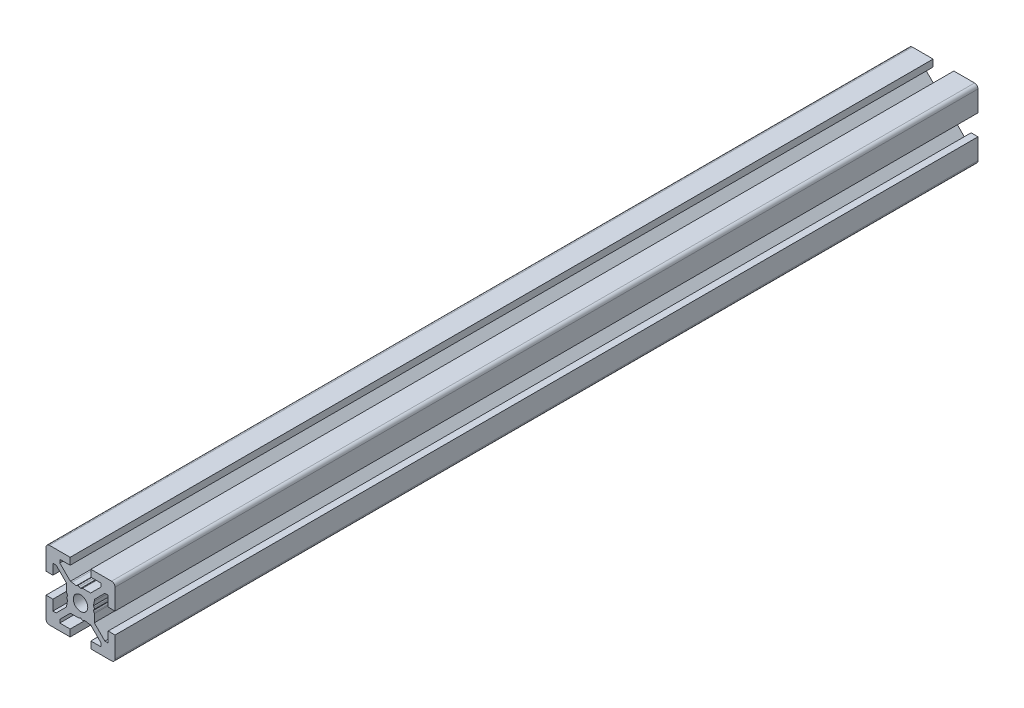
from build123d import *

# Parameters (mm, degrees)
SKETCH1_R           = 2.1
BOSS_EXTRUDE1_DEPTH = 250


with BuildPart() as part:
    # Sketch1 → Boss-Extrude1 (new body)
    with BuildSketch(Plane(origin=(0, 0, -2000), x_dir=(-1, 0, 0), z_dir=(0, 0, -1))):
        with BuildLine():
            Line((10, -3), (8, -3))
            Line((8, -3), (8, -6))
            Line((8, -6), (7.060660172, -6))
            Line((7.060660172, -6), (4, -2.939339828))
            Line((4, -2.939339828), (4, -2.5))
            Line((4, -2.5), (3.750976592, -1.218885629))
            Line((3.750976592, -1.218885629), (3.933012702, -0.903589838))
            ThreePointArc((3.933012702, -0.903589838), (4, -0.653589838), (3.933012702, -0.403589838))
            Line((3.933012702, -0.403589838), (3.7, 0))
            Line((3.7, 0), (3.933012702, 0.403589838))
            ThreePointArc((3.933012702, 0.403589838), (3.982962913, 0.524180316), (4, 0.653589838))
            Line((4, 0.653589838), (4, 2.939339828))
            Line((4, 2.939339828), (7.060660172, 6))
            Line((7.060660172, 6), (8, 6))
            Line((8, 6), (8, 3))
            Line((8, 3), (10, 3))
            Line((10, 3), (10, 9))
            ThreePointArc((10, 9), (9.707106781, 9.707106781), (9, 10))
            Line((9, 10), (3, 10))
            Line((3, 10), (3, 8))
            Line((3, 8), (6, 8))
            Line((6, 8), (6, 7.060660172))
            Line((6, 7.060660172), (2.939339828, 4))
            Line((2.939339828, 4), (2.5, 4))
            Line((2.5, 4), (1.218885629, 3.750976592))
            Line((1.218885629, 3.750976592), (0.903589838, 3.933012702))
            ThreePointArc((0.903589838, 3.933012702), (0.653589838, 4), (0.403589838, 3.933012702))
            Line((0.403589838, 3.933012702), (0, 3.7))
            Line((0, 3.7), (-0.403589838, 3.933012702))
            ThreePointArc((-0.403589838, 3.933012702), (-0.524180316, 3.982962913), (-0.653589838, 4))
            Line((-0.653589838, 4), (-2.939339828, 4))
            Line((-2.939339828, 4), (-6, 7.060660172))
            Line((-6, 7.060660172), (-6, 8))
            Line((-6, 8), (-3, 8))
            Line((-3, 8), (-3, 10))
            Line((-3, 10), (-9, 10))
            ThreePointArc((-9, 10), (-9.707106781, 9.707106781), (-10, 9))
            Line((-10, 9), (-10, 3))
            Line((-10, 3), (-8, 3))
            Line((-8, 3), (-8, 6))
            Line((-8, 6), (-7.060660172, 6))
            Line((-7.060660172, 6), (-4, 2.939339828))
            Line((-4, 2.939339828), (-4, 2.5))
            Line((-4, 2.5), (-3.750976592, 1.218885629))
            Line((-3.750976592, 1.218885629), (-3.933012702, 0.903589838))
            ThreePointArc((-3.933012702, 0.903589838), (-4, 0.653589838), (-3.933012702, 0.403589838))
            Line((-3.933012702, 0.403589838), (-3.7, 0))
            Line((-3.7, 0), (-3.933012702, -0.403589838))
            ThreePointArc((-3.933012702, -0.403589838), (-3.982962913, -0.524180316), (-4, -0.653589838))
            Line((-4, -0.653589838), (-4, -2.939339828))
            Line((-4, -2.939339828), (-7.060660172, -6))
            Line((-7.060660172, -6), (-8, -6))
            Line((-8, -6), (-8, -3))
            Line((-8, -3), (-10, -3))
            Line((-10, -3), (-10, -9))
            ThreePointArc((-10, -9), (-9.707106781, -9.707106781), (-9, -10))
            Line((-9, -10), (-3, -10))
            Line((-3, -10), (-3, -8))
            Line((-3, -8), (-6, -8))
            Line((-6, -8), (-6, -7.060660172))
            Line((-6, -7.060660172), (-2.939339828, -4))
            Line((-2.939339828, -4), (-2.5, -4))
            Line((-2.5, -4), (-1.218885629, -3.750976592))
            Line((-1.218885629, -3.750976592), (-0.903589838, -3.933012702))
            ThreePointArc((-0.903589838, -3.933012702), (-0.653589838, -4), (-0.403589838, -3.933012702))
            Line((-0.403589838, -3.933012702), (0, -3.7))
            Line((0, -3.7), (0.403589838, -3.933012702))
            ThreePointArc((0.403589838, -3.933012702), (0.524180316, -3.982962913), (0.653589838, -4))
            Line((0.653589838, -4), (2.939339828, -4))
            Line((2.939339828, -4), (6, -7.060660172))
            Line((6, -7.060660172), (6, -8))
            Line((6, -8), (3, -8))
            Line((3, -8), (3, -10))
            Line((3, -10), (9, -10))
            ThreePointArc((9, -10), (9.707106781, -9.707106781), (10, -9))
            Line((10, -9), (10, -3))
        make_face()
        with Locations(Location((0, 0, 0), (0, 0, 180))):
            Circle(SKETCH1_R, mode=Mode.SUBTRACT)
    extrude(amount=-BOSS_EXTRUDE1_DEPTH)


solid = part.part
